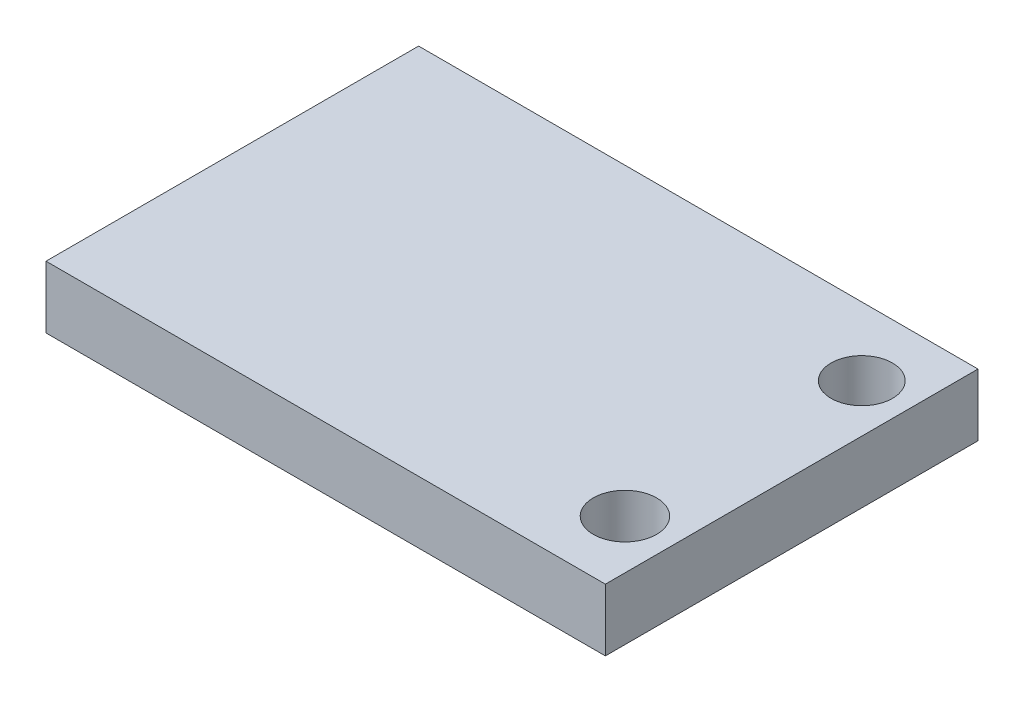
from build123d import *

# Parameters (mm, degrees)
SKETCH1_W           = 114.261019043
SKETCH1_H           = 76.109285411
BOSS_EXTRUDE1_DEPTH = 12.7
SKETCH2_R           = 6.465438967
CUT_EXTRUDE1_DEPTH  = 28.194
SKETCH3_R           = 6.272780884
CUT_EXTRUDE2_DEPTH  = 31.242


with BuildPart() as part:
    # Sketch1 → Boss-Extrude1 (new body)
    with BuildSketch(Plane(origin=(0, 0, 0), x_dir=(1, 0, 0), z_dir=(0, 1, 0))):
        with Locations((-57.130509522, 38.054642706)):
            Rectangle(SKETCH1_W, SKETCH1_H)
    extrude(amount=-BOSS_EXTRUDE1_DEPTH)

    # Sketch2 → Cut-Extrude1 (cut)
    with BuildSketch(Plane.XZ.offset(12.7)):
        with Locations(Location((-10.03566432, -14.029659272, 0), (0, 0, 270))):
            Circle(SKETCH2_R)
    extrude(amount=-CUT_EXTRUDE1_DEPTH, mode=Mode.SUBTRACT)

    # Sketch3 → Cut-Extrude2 (cut)
    with BuildSketch(Plane.XZ.offset(12.7)):
        with Locations(Location((-9.80844034, -62.176336471, 0), (0, 0, 270))):
            Circle(SKETCH3_R)
    extrude(amount=-CUT_EXTRUDE2_DEPTH, mode=Mode.SUBTRACT)


solid = part.part
